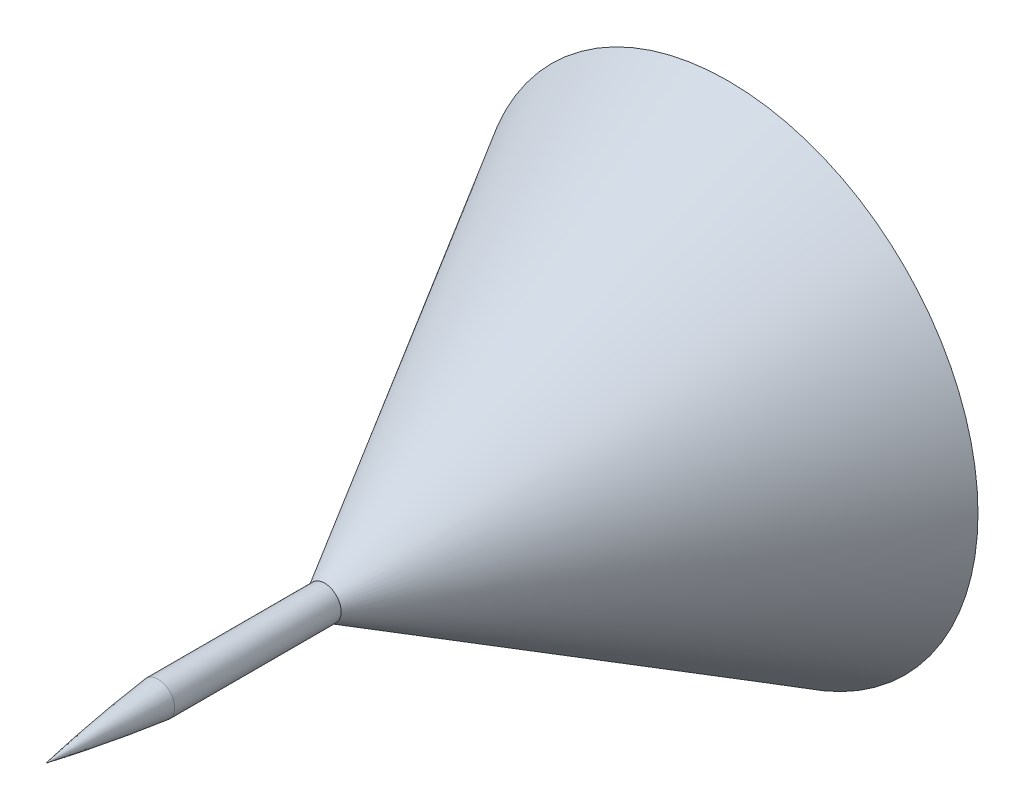
from build123d import *


with BuildPart() as part:
    # 草圖1 → 旋轉1 (revolve)
    with BuildSketch(Plane(origin=(0, 0, 0), x_dir=(0, 0, -1), z_dir=(1, 0, 0)), mode=Mode.PRIVATE) as revolve_1_sk:
        Polygon((0, 0), (12.990381057, 7.5), (12.990381057, 6.345299462), (2, 0), align=None)
    revolve(revolve_1_sk.sketch.rotate(Axis((0, 0, 0), (0, 0, -1)), 270), axis=Axis((0, 0, 0), (0, 0, -1)))

    # 草圖5 → 旋轉2 (revolve)
    with BuildSketch(Plane(origin=(0, 0, 0), x_dir=(1, 0, 0), z_dir=(0, 1, 0))):
        with BuildLine():
            Line((-0.5, -4.133974596), (-0.5, 0.866025404))
            Line((-0.5, 0.866025404), (0, 0))
            Line((0, 0), (0, -7.5))
            add(Edge.make_bspline(
                [(-0.5, -4.133974596), (-0.311933275, -5.826681962), (0, -7.5)],
                knots=[0, 0, 0, 1, 1, 1], degree=2))
        make_face()
    revolve(axis=Axis((0, 0, 0), (0, 0, 1)))


solid = part.part
